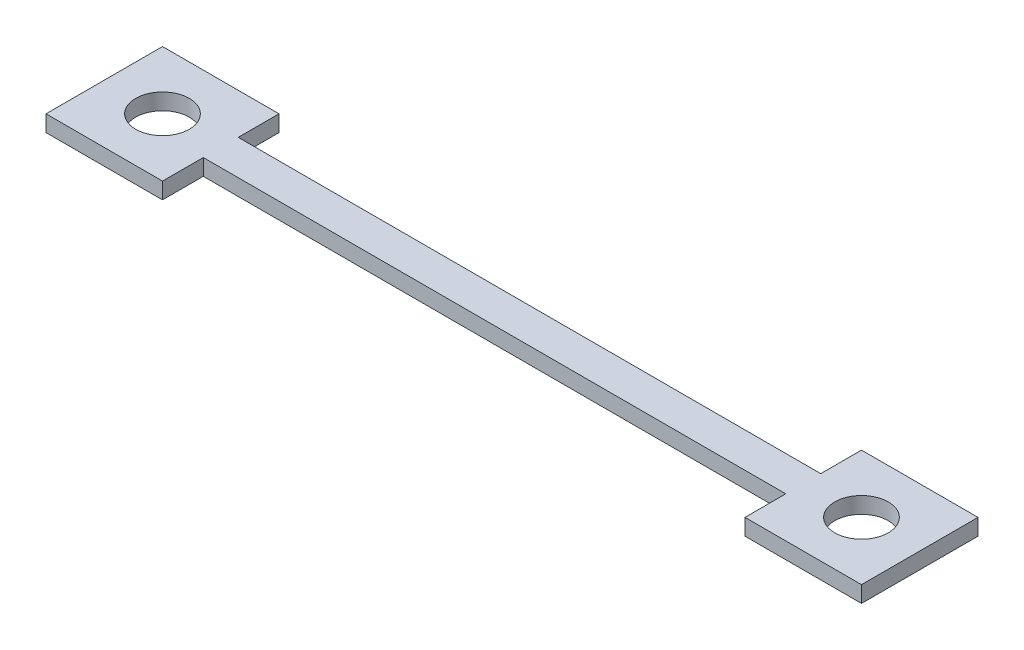
from build123d import *

# Parameters (mm, degrees)
BOSS_EXTRUDE1_DEPTH          = 0.4445
F_97_0_0059_DIAMETER_HOLE1_D = 2.921


with BuildPart() as part:
    # Sketch1 → Boss-Extrude1 (new, symmetric)
    with BuildSketch(Plane(origin=(0, 0, 0), x_dir=(1, 0, 0), z_dir=(0, 1, 0))):
        Polygon((-41.424046485, -10.283259465), (-41.424046485, -12.505759465), (-47.774046485, -12.505759465), (-47.774046485, -6.155759465), (-41.424046485, -6.155759465), (-41.424046485, -8.378259465), (-9.674046485, -8.378259465), (-9.674046485, -6.155759465), (-3.324046485, -6.155759465), (-3.324046485, -12.505759465), (-9.674046485, -12.505759465), (-9.674046485, -10.283259465), align=None)
    extrude(amount=BOSS_EXTRUDE1_DEPTH, both=True)

    # #97 (0.0059) Diameter Hole1 (through all)
    with Locations(Plane(origin=(0, 0.4445, 0), x_dir=(-1, 0, 0), z_dir=(0, 1, 0))):
        with Locations((44.599046485, 9.330759465)):
            f_97_0_0059_diameter_hole1 = Hole(F_97_0_0059_DIAMETER_HOLE1_D / 2)

    # Mirror1: #97 (0.0059) Diameter Hole1 across plane
    add(f_97_0_0059_diameter_hole1.mirror(Plane(origin=(-25.549046485, 0, 0), x_dir=(0, 0, 1), z_dir=(1, 0, 0))), mode=Mode.SUBTRACT)


solid = part.part
